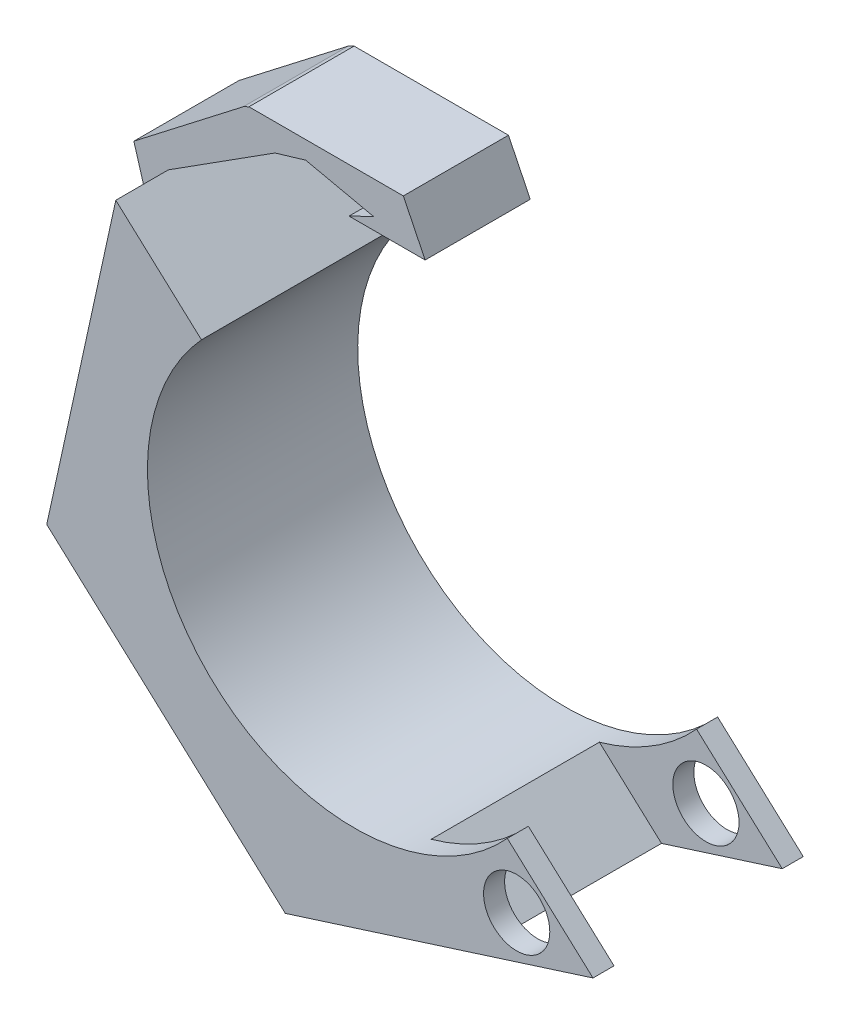
from build123d import *

# Parameters (mm, degrees)
BOSS_EXTRUDE1_DEPTH     = 12.7
CUT_EXTRUDE1_DEPTH      = 10.16
CUT_EXTRUDE2_DEPTH      = 59.972520527
CUT_EXTRUDE2_DEPTH_BACK = 59.972520527
SKETCH3_R               = 4
BOSS_EXTRUDE2_DEPTH     = 6.35


with BuildPart() as part:
    # Sketch1 → Boss-Extrude1 (new, symmetric)
    with BuildSketch(Plane.XY):
        with BuildLine():
            Line((-18.475736443, 16.841827778), (-28.822148851, 26.273251333))
            Line((-28.822148851, 26.273251333), (-37.16437752, -11.82408743))
            Line((-37.16437752, -11.82408743), (-8.342228669, -38.097338763))
            Line((-8.342228669, -38.097338763), (28.822148851, -26.273251333))
            Line((28.822148851, -26.273251333), (18.475736443, -16.841827778))
            ThreePointArc((18.475736443, -16.841827778), (-16.841827778, -18.475736443), (-18.475736443, 16.841827778))
        make_face()
    extrude(amount=BOSS_EXTRUDE1_DEPTH, both=True)

    # Sketch2 → Cut-Extrude1 (cut, symmetric)
    with BuildSketch(Plane.XY):
        Polygon((3.04575912, -20.713698515), (17.349372708, -33.752366684), (38.911165868, -25.491143251), (19.249454098, -2.938003279), align=None)
    extrude(amount=CUT_EXTRUDE1_DEPTH, both=True, mode=Mode.SUBTRACT)

    # Sketch3 → Cut-Extrude2 (cut, two sides: drawn at the far end of the back side and taken through both)
    with BuildSketch(Plane.XY.offset(12.7).offset(-CUT_EXTRUDE2_DEPTH_BACK)):
        with Locations((19.603889038, -24.050389858)):
            Circle(SKETCH3_R)
    extrude(amount=CUT_EXTRUDE2_DEPTH + CUT_EXTRUDE2_DEPTH_BACK, mode=Mode.SUBTRACT)

    # Sketch5 → Boss-Extrude2 (add, symmetric)
    with BuildSketch(Plane.XY):
        Polygon((-30.477907749, 18.711721897), (-32.993263185, 27.186606195), (-19.756729053, 37.411947448), (-19.086323313, 37.739354902), (-0.437878578, 37.739354902), (2.195133213, 32.347949806), (-6.996558268, 32.347949806), (-4.046072735, 33.788884601), (-12.229481166, 35.580817231), (-15.939758745, 34.479602565), (-28.822148851, 26.273251333), align=None)
    extrude(amount=BOSS_EXTRUDE2_DEPTH, both=True)


solid = part.part
